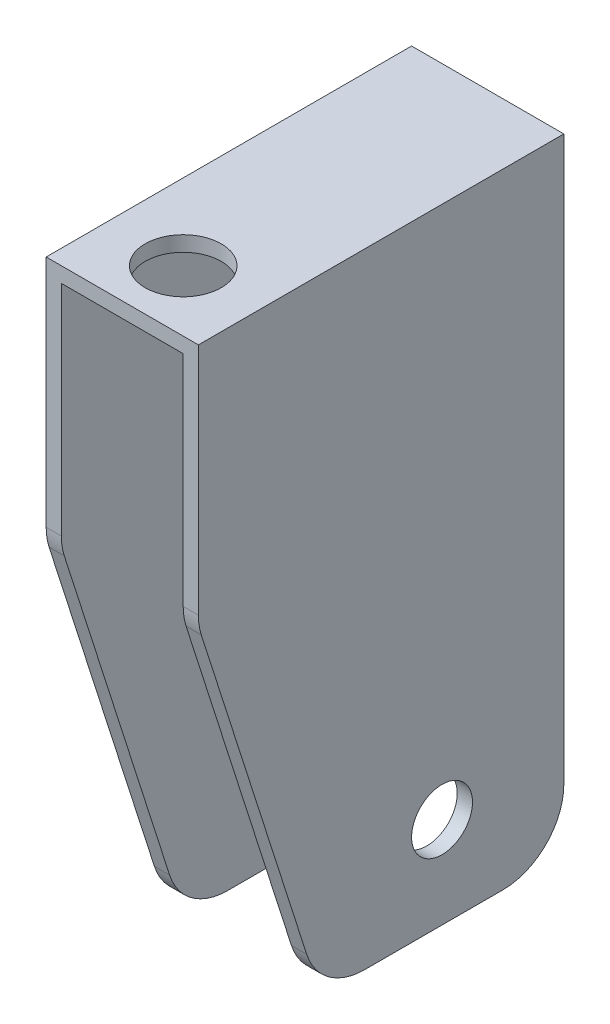
from build123d import *

# Parameters (mm, degrees)
BOSS_EXTRU_1_DEPTH           = 120
ENL_V_MAT_EXTRU_1_DEPTH      = 243.744721879
ENL_V_MAT_EXTRU_1_DEPTH_BACK = 243.744721879
ENL_V_MAT_EXTRU_2_DEPTH      = 243.744721879
ENL_V_MAT_EXTRU_2_DEPTH_BACK = 243.744721879
ESQUISSE3_R                  = 10
CONG_1_R                     = 20
ENL_V_MAT_EXTRU_3_REACH      = 244.745
ESQUISSE4_R                  = 12.5


with BuildPart() as part:
    # Esquisse1 → Boss.-Extru.1 (new body)
    with BuildSketch(Plane.XY):
        Polygon((0, 0), (0, 205), (50, 205), (50, 0), (45, 0), (45, 200), (5, 200), (5, 0), align=None)
    extrude(amount=BOSS_EXTRU_1_DEPTH)

    # Esquisse2 → Enlèv. mat.-Extru.1 (cut, two sides: drawn at the far end of the back side and taken through both)
    with BuildSketch(Plane(origin=(50, 0, 0), x_dir=(0, 0, -1), z_dir=(1, 0, 0)).offset(-ENL_V_MAT_EXTRU_1_DEPTH_BACK)):
        Polygon((-80, 0), (-120, 125), (-120, 0), align=None)
    extrude(amount=ENL_V_MAT_EXTRU_1_DEPTH + ENL_V_MAT_EXTRU_1_DEPTH_BACK, mode=Mode.SUBTRACT)

    # Esquisse3 → Enlèv. mat.-Extru.2 (cut, two sides: drawn at the far end of the back side and taken through both)
    with BuildSketch(Plane(origin=(50, 0, 0), x_dir=(0, 0, -1), z_dir=(1, 0, 0)).offset(-ENL_V_MAT_EXTRU_2_DEPTH_BACK)):
        with Locations(Location((-40, 30, 0), (0, 0, 90))):
            Circle(ESQUISSE3_R)
    extrude(amount=ENL_V_MAT_EXTRU_2_DEPTH + ENL_V_MAT_EXTRU_2_DEPTH_BACK, mode=Mode.SUBTRACT)

    # Congé1
    cong_1_edges = [part.edges().sort_by_distance(p)[0] for p in [
        (2.5, 125, 120),
        (47.5, 125, 120),
        (2.5, 0, 80),
        (47.5, 0, 80),
        (2.5, 0, 0),
        (47.5, 0, 0),
    ]]
    fillet(cong_1_edges, radius=CONG_1_R)

    # Esquisse4 → Enlèv. mat.-Extru.3 (cut, up to next)
    with BuildSketch(Plane(origin=(0, 205, 0), x_dir=(1, 0, 0), z_dir=(0, 1, 0)), mode=Mode.PRIVATE) as enl_v_mat_extru_3_sk1:
        with Locations(Location((25, -100, 0), (0, 0, 270))):
            Circle(ESQUISSE4_R)
    enl_v_mat_extru_3_tool1 = extrude(enl_v_mat_extru_3_sk1.sketch, amount=-ENL_V_MAT_EXTRU_3_REACH, mode=Mode.PRIVATE) & part.part
    add(enl_v_mat_extru_3_tool1.solids().sort_by_distance((25, 205, 100))[0], mode=Mode.SUBTRACT)


solid = part.part
